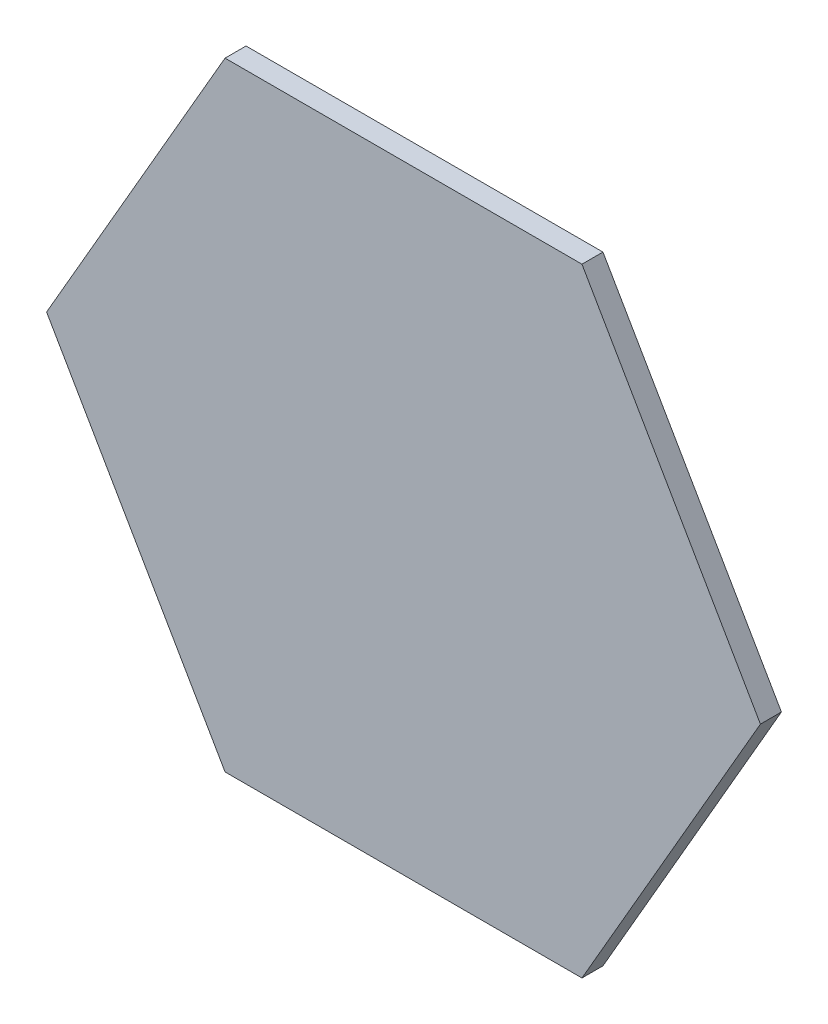
from build123d import *

# Parameters (mm, degrees)
BOSS_EXTRUDE1_DEPTH = 2


with BuildPart() as part:
    # Sketch1 → Boss-Extrude1 (new body)
    with BuildSketch(Plane.XY):
        Polygon((34, 0), (17, 29.444863729), (-17, 29.444863729), (-34, 0), (-17, -29.444863729), (17, -29.444863729), align=None)
    extrude(amount=BOSS_EXTRUDE1_DEPTH)


solid = part.part
